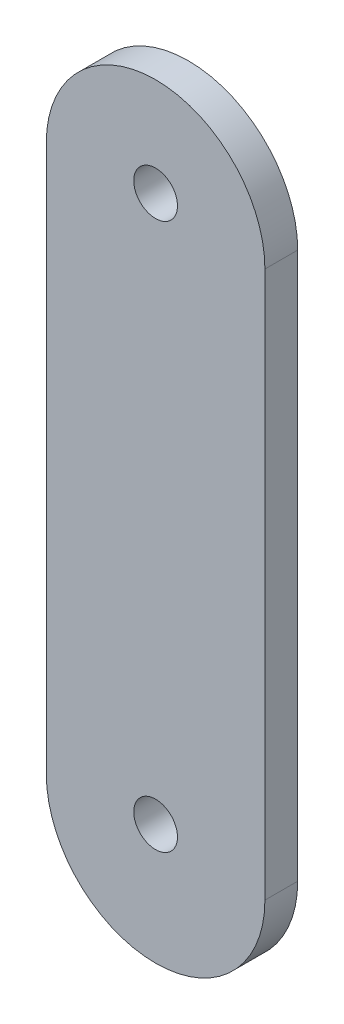
from build123d import *

# Parameters (mm, degrees)
SKETCH1_R           = 2
BOSS_EXTRUDE1_DEPTH = 3


with BuildPart() as part:
    # Sketch1 → Boss-Extrude1 (new body)
    with BuildSketch(Plane.XY):
        with BuildLine():
            Line((10, 25), (10, -25))
            ThreePointArc((10, -25), (0, -35), (-10, -25))
            Line((-10, -25), (-10, 25))
            ThreePointArc((-10, 25), (0, 35), (10, 25))
        make_face()
        with Locations((0, 26)):
            Circle(SKETCH1_R, mode=Mode.SUBTRACT)
        with Locations((0, -24)):
            Circle(SKETCH1_R, mode=Mode.SUBTRACT)
    extrude(amount=BOSS_EXTRUDE1_DEPTH)


solid = part.part
